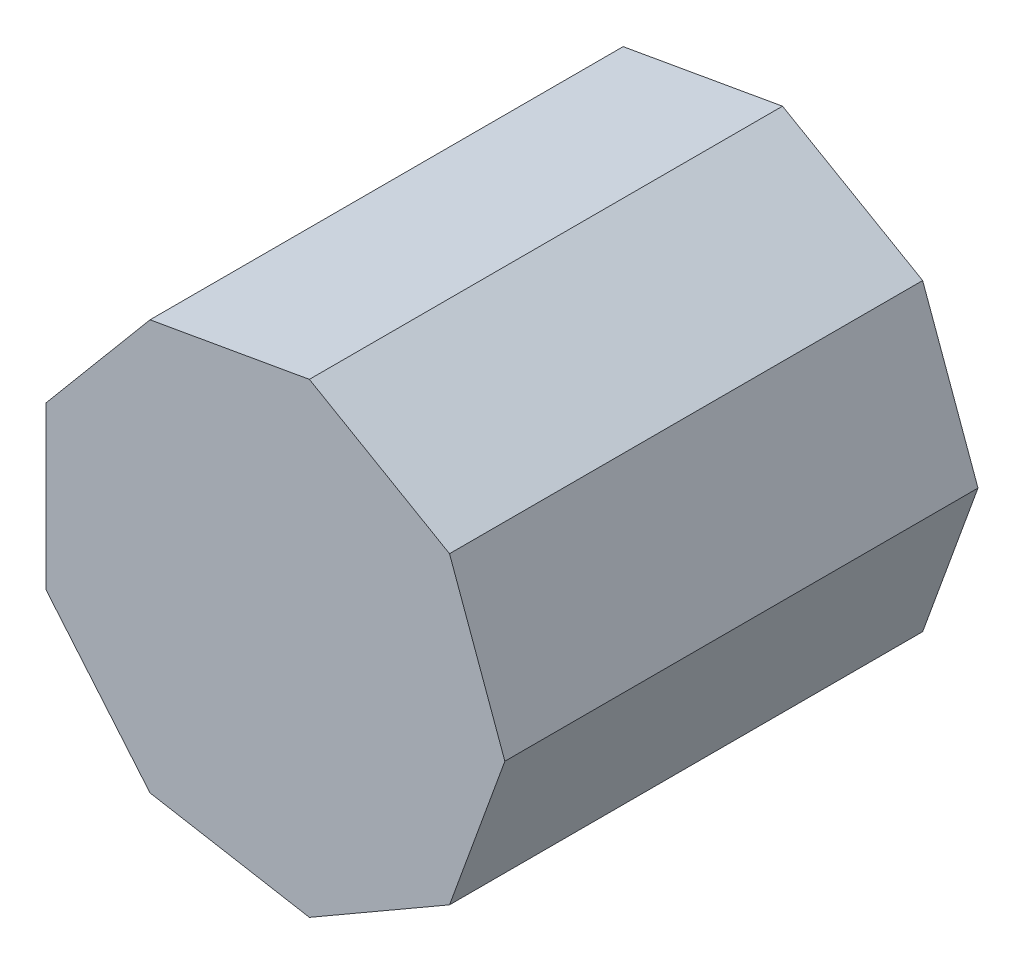
from build123d import *

# Parameters (mm, degrees)
BOSS_EXTRUDE1_DEPTH = 20


with BuildPart() as part:
    # Sketch1 → Boss-Extrude1 (new body)
    with BuildSketch(Plane.XY):
        Polygon((7.660444431, 6.427876097), (10, 0), (7.660444431, -6.427876097), (1.736481777, -9.84807753), (-5, -8.660254038), (-9.396926208, -3.420201433), (-9.396926208, 3.420201433), (-5, 8.660254038), (1.736481777, 9.84807753), align=None)
    extrude(amount=BOSS_EXTRUDE1_DEPTH)


solid = part.part
